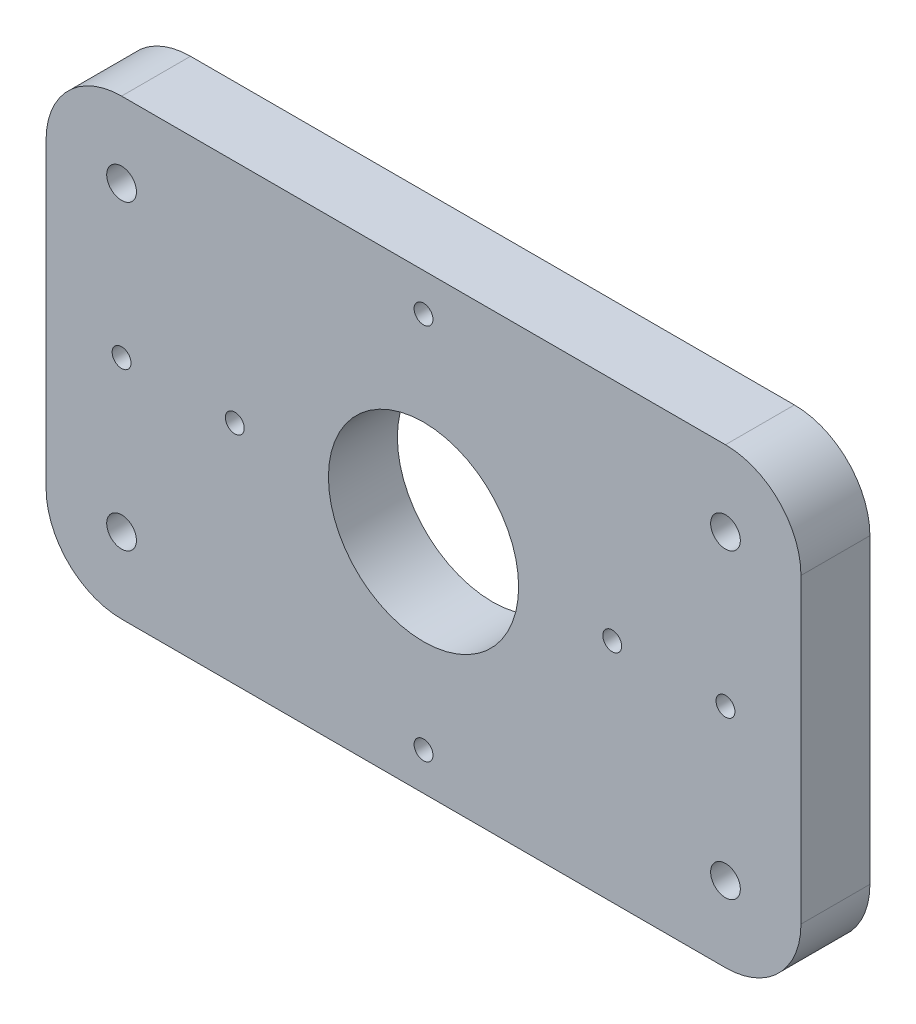
from build123d import *

# Parameters (mm, degrees)
SKETCH1_W                 = 38.1
SKETCH1_H                 = 38.1
BOSS_EXTRUDE1_DEPTH       = 5.8
SKETCH2_R                 = 8
CUT_EXTRUDE1_DEPTH        = 12.7
SKETCH4_R                 = 0.79375
CUT_EXTRUDE3_DEPTH        = 55.19280395
SKETCH6_W                 = 12.7
SKETCH6_H                 = 38.1
BOSS_EXTRUDE2_DEPTH       = 5.8
M3X0_5_TAPPED_HOLE1_D     = 2.5
M3X0_5_TAPPED_HOLE1_DEPTH = 7.5
M3X0_5_TAPPED_HOLE1_TIP   = 0.751075774
SKETCH9_R                 = 0.79375
CUT_EXTRUDE4_DEPTH        = 64.764331722
FILLET1_R                 = 6.35


with BuildPart() as part:
    # Sketch1 → Boss-Extrude1 (new body)
    with BuildSketch(Plane.XY):
        with Locations((-19.05, 19.05)):
            Rectangle(SKETCH1_W, SKETCH1_H)
    extrude(amount=BOSS_EXTRUDE1_DEPTH)

    # Sketch2 → Cut-Extrude1 (cut)
    with BuildSketch(Plane.XY.offset(5.8)):
        with Locations((-19.05, 19.05)):
            Circle(SKETCH2_R)
    extrude(amount=-CUT_EXTRUDE1_DEPTH, mode=Mode.SUBTRACT)

    # Sketch4 → Cut-Extrude3 (cut, through all)
    with BuildSketch(Plane.XY.offset(5.8)):
        with Locations((-34.925, 19.05)):
            Circle(SKETCH4_R)
        with Locations((-19.05, 34.925)):
            Circle(SKETCH4_R)
        with Locations((-3.175, 19.05)):
            Circle(SKETCH4_R)
        with Locations((-19.05, 3.175)):
            Circle(SKETCH4_R)
    extrude(amount=-CUT_EXTRUDE3_DEPTH, mode=Mode.SUBTRACT)

    # Sketch6 → Boss-Extrude2 (add, through all)
    with BuildSketch(Plane.XY.offset(5.8)):
        with Locations((6.35, 19.05)):
            Rectangle(SKETCH6_W, SKETCH6_H)
        with Locations((-44.45, 19.05)):
            Rectangle(SKETCH6_W, SKETCH6_H)
    extrude(amount=-BOSS_EXTRUDE2_DEPTH)

    # M3x0.5 Tapped Hole1
    with Locations(Plane.XY.offset(5.8)):
        with Locations((-44.45, 31.75), (6.35, 31.75), (6.35, 6.35), (-44.45, 6.35)):
            Hole(M3X0_5_TAPPED_HOLE1_D / 2, depth=M3X0_5_TAPPED_HOLE1_DEPTH)
            with Locations((0, 0, -(M3X0_5_TAPPED_HOLE1_DEPTH + M3X0_5_TAPPED_HOLE1_TIP / 2))):  # 118° drill point
                Cone(0, M3X0_5_TAPPED_HOLE1_D / 2, M3X0_5_TAPPED_HOLE1_TIP, mode=Mode.SUBTRACT)

    # Sketch9 → Cut-Extrude4 (cut, through all)
    with BuildSketch(Plane.XY.offset(5.8)):
        with Locations((-44.45, 19.05)):
            Circle(SKETCH9_R)
        with Locations((6.35, 19.05)):
            Circle(SKETCH9_R)
    extrude(amount=-CUT_EXTRUDE4_DEPTH, mode=Mode.SUBTRACT)

    # Fillet1
    fillet1_edges = [part.edges().sort_by_distance(p)[0] for p in [
        (12.7, 38.1, 2.9),
        (12.7, 0, 2.9),
        (-50.8, 0, 2.9),
        (-50.8, 38.1, 2.9),
    ]]
    fillet(fillet1_edges, radius=FILLET1_R)


solid = part.part
